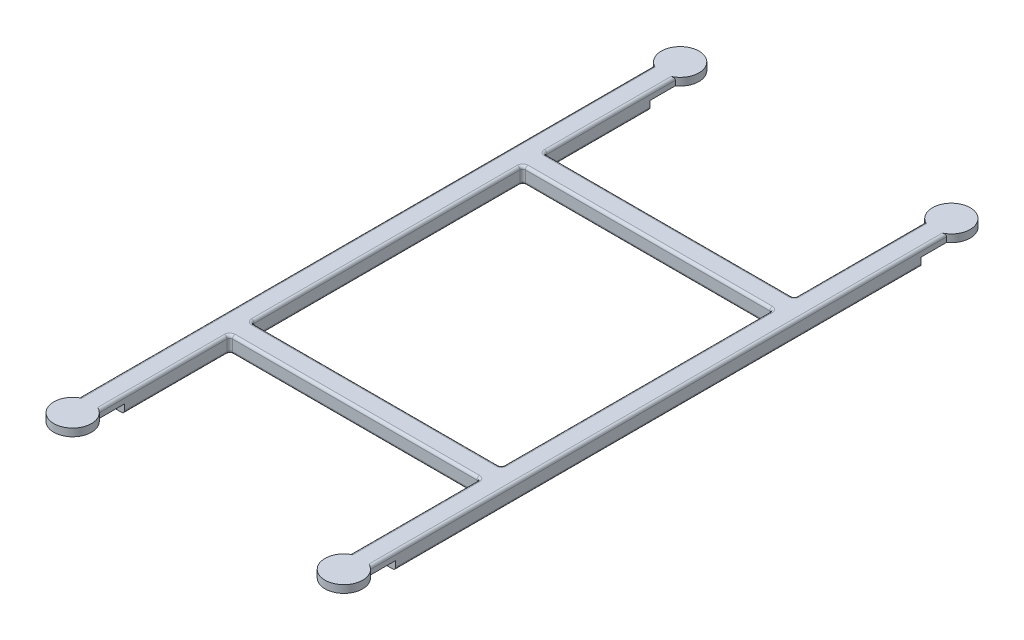
from build123d import *

# Parameters (mm, degrees)
BOSS_EXTRUDE1_DEPTH = 6
CUT_EXTRUDE1_DEPTH  = 3.2
SKETCH4_R           = 3
SKETCH4_R_2         = 2
CUT_EXTRUDE2_DEPTH  = 2
SKETCH2_W           = 92.1
SKETCH2_H           = 8
BOSS_EXTRUDE2_DEPTH = 6
FILLET1_R           = 1


with BuildPart() as part:
    # Sketch1 → Boss-Extrude1 (new body)
    with BuildSketch(Plane(origin=(0, 0, 0), x_dir=(1, 0, 0), z_dir=(0, 1, 0))):
        with BuildLine():
            Line((-53.95, 0), (-53.95, 106.281608618))
            ThreePointArc((-53.95, 106.281608618), (-50, 118.95), (-46.05, 106.281608618))
            Line((-46.05, 106.281608618), (-46.05, 0))
            Line((-46.05, 0), (-53.95, 0))
        make_face()
    extrude(amount=BOSS_EXTRUDE1_DEPTH)

    # Sketch3 → Cut-Extrude1 (cut)
    with BuildSketch(Plane.XZ):
        with BuildLine():
            Line((-53.95, -106.281608618), (-53.95, -96.9))
            Line((-53.95, -96.9), (-46.05, -96.9))
            Line((-46.05, -96.9), (-46.05, -106.281608618))
            ThreePointArc((-46.05, -106.281608618), (-50, -118.95), (-53.95, -106.281608618))
        make_face()
    extrude(amount=-CUT_EXTRUDE1_DEPTH, mode=Mode.SUBTRACT)

    # Sketch4 → Cut-Extrude2 (cut)
    with BuildSketch(Plane.XZ.offset(-3.2)):
        with Locations(Location((-50, -112, 0), (0, 0, 270))):
            Circle(SKETCH4_R)
        with Locations(Location((-50, -102, 0), (0, 0, 270))):
            Circle(SKETCH4_R_2)
    extrude(amount=-CUT_EXTRUDE2_DEPTH, mode=Mode.SUBTRACT)


with BuildPart() as body_2:
    # Mirror3: mirrored copy
    add(part.part.mirror(Plane(origin=(0, 0, 0), x_dir=(0, 0, 1), z_dir=(1, 0, 0))))

    # Mirror4 2: body 2 across plane


with BuildPart() as part_1:
    add(part.part)

    # Mirror4: part across plane
    add(part.part.mirror(Plane.XY))



with BuildPart() as body_2_1:
    add(body_2.part)
    add(body_2.part.mirror(Plane.XY))


with BuildPart() as part_2:
    add(part_1.part)

    add(body_2_1.part)  # Boss-Extrude2 merges body 2
    # Sketch2 → Boss-Extrude2 (add)
    with BuildSketch(Plane(origin=(0, 6, 0), x_dir=(1, 0, 0), z_dir=(0, 1, 0))):
        with Locations((0, 54)):
            Rectangle(SKETCH2_W, SKETCH2_H)
        with Locations((0, -54)):
            Rectangle(SKETCH2_W, SKETCH2_H)
    extrude(amount=-BOSS_EXTRUDE2_DEPTH)

    # Fillet1
    fillet1_edges = [part_2.edges().sort_by_distance(p)[0] for p in [
        (-46.05, 0, 0),
        (-46.05, 6, 0),
        (46.05, 3, 50),
        (46.05, 3, 58),
        (-46.05, 3, 58),
        (-46.05, 3, 50),
        (0, 6, 50),
        (0, 6, 58),
        (0, 0, 58),
        (0, 0, 50),
        (-53.95, 0, 0),
        (-53.95, 6, 0),
        (-46.05, 0, 77.45),
        (-46.05, 0, -77.45),
        (-46.05, 6, -82.140804309),
        (-46.05, 3, -50),
        (-46.05, 3, -58),
        (46.05, 3, -58),
        (46.05, 3, -50),
        (0, 6, -50),
        (0, 6, -58),
        (0, 0, -58),
        (0, 0, -50),
        (46.05, 6, -82.140804309),
        (46.05, 6, 82.140804309),
        (53.95, 6, 0),
        (53.95, 0, 0),
        (46.05, 0, 77.45),
        (46.05, 0, -77.45),
        (-46.05, 6, 82.140804309),
        (46.05, 0, 0),
        (46.05, 6, 0),
    ]]
    fillet(fillet1_edges, radius=FILLET1_R)


solid = part_2.part
